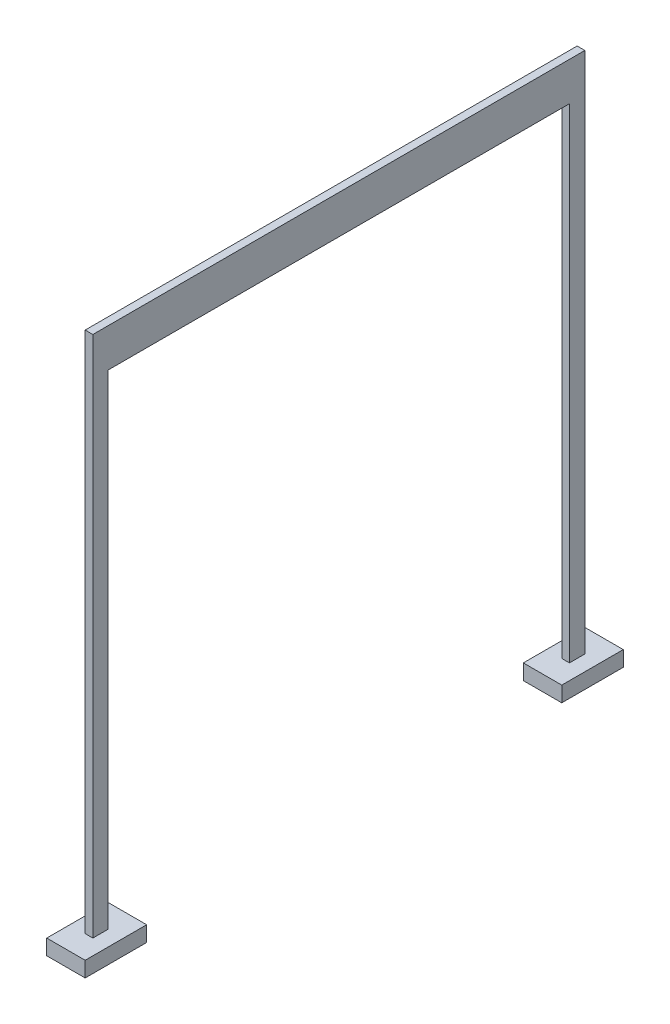
from build123d import *

# Parameters (mm, degrees)
EXTRUDE_1_DEPTH = 5
SKETCH_1_3_W    = 80
SKETCH_1_3_H    = 20
EXTRUDE_2_DEPTH = 25


with BuildPart() as part:
    # 草图1 → 凸台-拉伸1 (new, symmetric)
    with BuildSketch(Plane(origin=(0, 0, 0), x_dir=(0, 0, -1), z_dir=(1, 0, 0))):
        Polygon((320, -655), (320, 25), (-320, 25), (-320, -655), (-350, -655), (-350, -675), (-270, -675), (-270, -655), (-300, -655), (-300, -25), (300, -25), (300, -655), (270, -655), (270, -675), (350, -675), (350, -655), align=None)
    extrude(amount=EXTRUDE_1_DEPTH, both=True)

    # 草图1<3> → 凸台-拉伸2 (add, symmetric)
    with BuildSketch(Plane(origin=(0, 0, 0), x_dir=(0, 0, -1), z_dir=(1, 0, 0))):
        with Locations((310, -665)):
            Rectangle(SKETCH_1_3_W, SKETCH_1_3_H)
        with Locations((-310, -665)):
            Rectangle(SKETCH_1_3_W, SKETCH_1_3_H)
    extrude(amount=EXTRUDE_2_DEPTH, both=True)


solid = part.part
